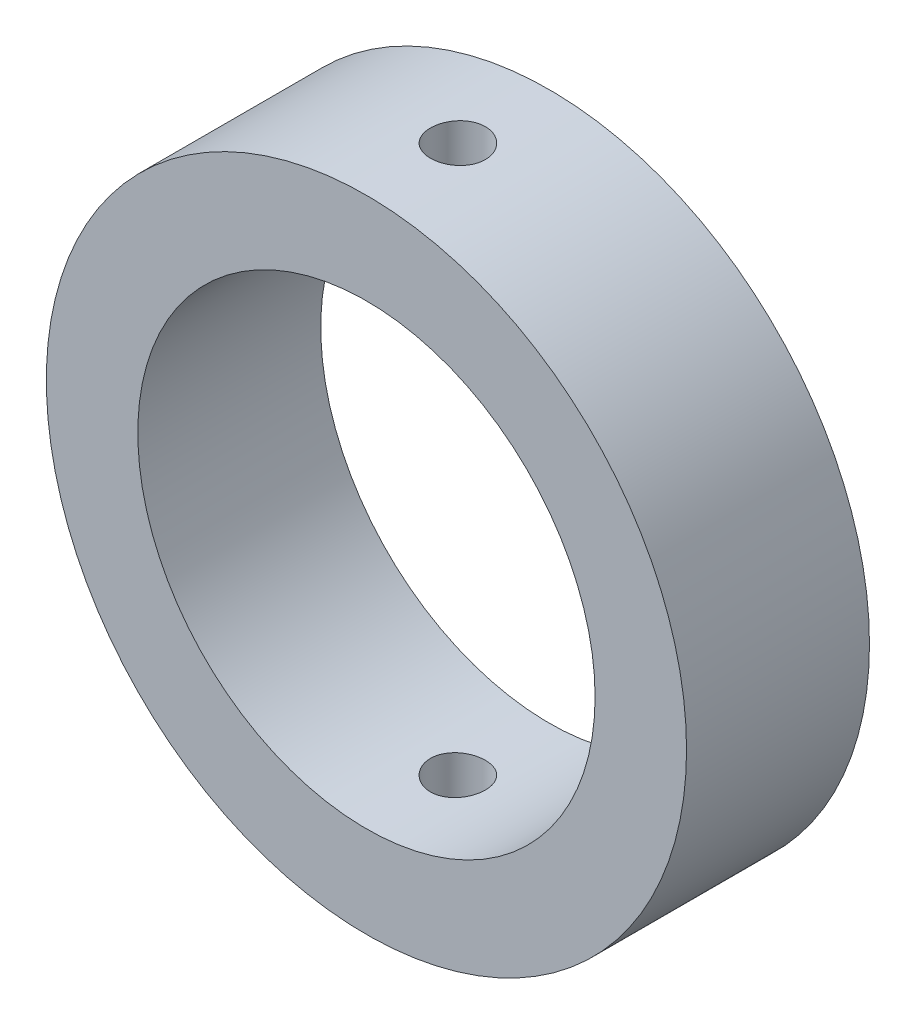
from build123d import *

# Parameters (mm, degrees)
SKETCH1_R               = 35
SKETCH1_R_2             = 25
BOSS_EXTRUDE1_DEPTH     = 20
CUT_EXTRUDE1_DEPTH      = 54.38539126
CUT_EXTRUDE1_DEPTH_BACK = 54.38539126
SKETCH2_R               = 3


with BuildPart() as part:
    # Sketch1 → Boss-Extrude1 (new body)
    with BuildSketch(Plane.XY):
        Circle(SKETCH1_R)
        Circle(SKETCH1_R_2, mode=Mode.SUBTRACT)
    extrude(amount=BOSS_EXTRUDE1_DEPTH)

    # Sketch2 → Cut-Extrude1 (cut, two sides: drawn at the far end of the back side and taken through both)
    with BuildSketch(Plane(origin=(0, 0, 0), x_dir=(1, 0, 0), z_dir=(0, 1, 0)).offset(-CUT_EXTRUDE1_DEPTH_BACK)):
        with Locations(Location((0, -10, 0), (0, 0, 270))):
            Circle(SKETCH2_R)
    extrude(amount=CUT_EXTRUDE1_DEPTH + CUT_EXTRUDE1_DEPTH_BACK, mode=Mode.SUBTRACT)


solid = part.part
